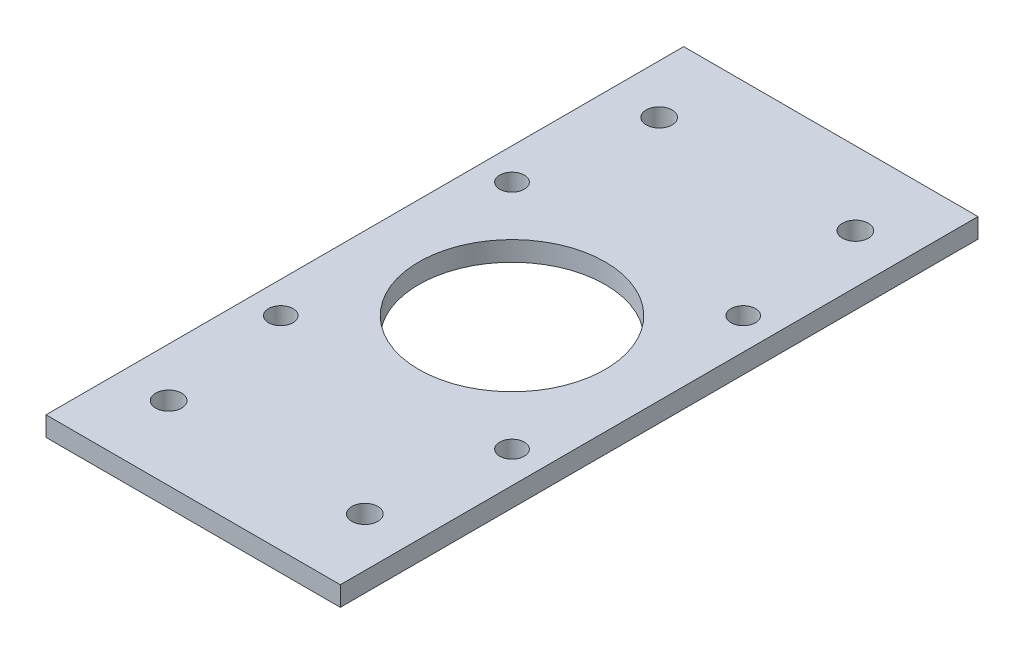
from build123d import *

# Parameters (mm, degrees)
ESBO_O1_W                = 60
ESBO_O1_H                = 130
RESSALTO_EXTRUS_O1_DEPTH = 4
ESBO_O2_R                = 19
ESBO_O2_R_2              = 2.5
CORTE_EXTRUS_O1_DEPTH    = 72.700767081
FURO_COM_FOLGA_DE_M51_D  = 5.3


with BuildPart() as part:
    # Esboço1 → Ressalto-extrusão1 (new body)
    with BuildSketch(Plane(origin=(0, 0, 0), x_dir=(1, 0, 0), z_dir=(0, 1, 0))):
        Rectangle(ESBO_O1_W, ESBO_O1_H)
    extrude(amount=RESSALTO_EXTRUS_O1_DEPTH)

    # Esboço2 → Corte-extrusão1 (cut, through all)
    with BuildSketch(Plane(origin=(0, 4, 0), x_dir=(1, 0, 0), z_dir=(0, 1, 0))):
        with Locations(Location((0, 0, 0), (0, 0, 270))):
            Circle(ESBO_O2_R)
        with Locations(Location((-23.57, 23.57, 0), (0, 0, 270))):
            Circle(ESBO_O2_R_2)
        with Locations(Location((23.57, 23.57, 0), (0, 0, 270))):
            Circle(ESBO_O2_R_2)
        with Locations(Location((23.57, -23.57, 0), (0, 0, 270))):
            Circle(ESBO_O2_R_2)
        with Locations(Location((-23.57, -23.57, 0), (0, 0, 270))):
            Circle(ESBO_O2_R_2)
    extrude(amount=-CORTE_EXTRUS_O1_DEPTH, mode=Mode.SUBTRACT)

    # Furo com folga de M51 (through all)
    with Locations(Plane(origin=(0, 4, 0), x_dir=(1, 0, 0), z_dir=(0, 1, 0))):
        with Locations((-20, -50), (20, -50), (-20, 50), (20, 50)):
            Hole(FURO_COM_FOLGA_DE_M51_D / 2)


solid = part.part
